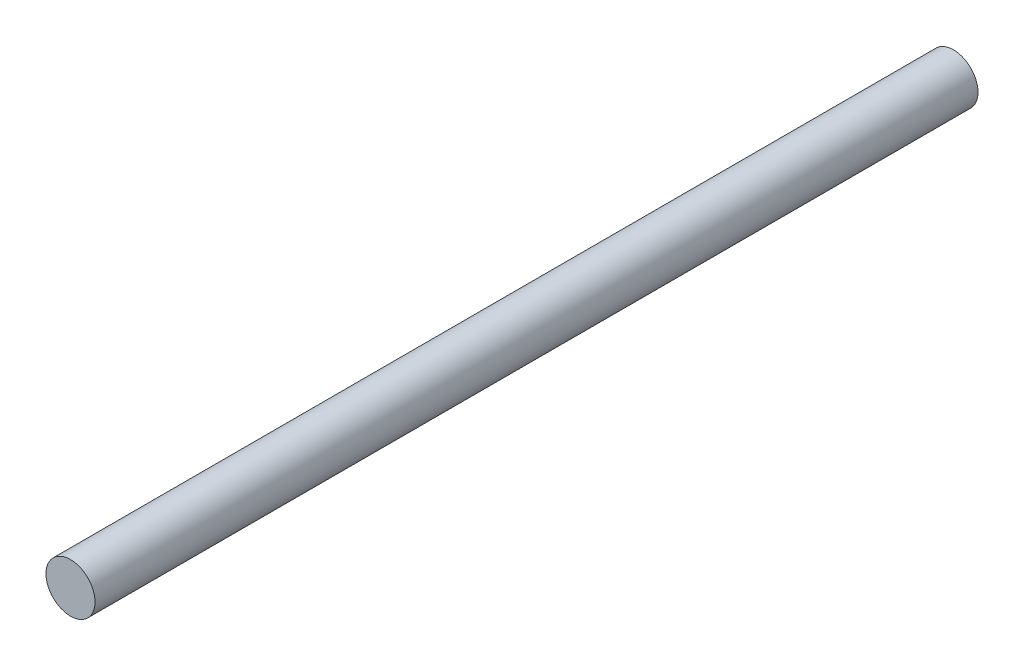
from build123d import *

# Parameters (mm, degrees)
ESQUISSE1_R        = 2.5
BOSS_EXTRU_1_DEPTH = 90


with BuildPart() as part:
    # Esquisse1 → Boss.-Extru.1 (new body)
    with BuildSketch(Plane.XY):
        Circle(ESQUISSE1_R)
    extrude(amount=-BOSS_EXTRU_1_DEPTH)


solid = part.part
